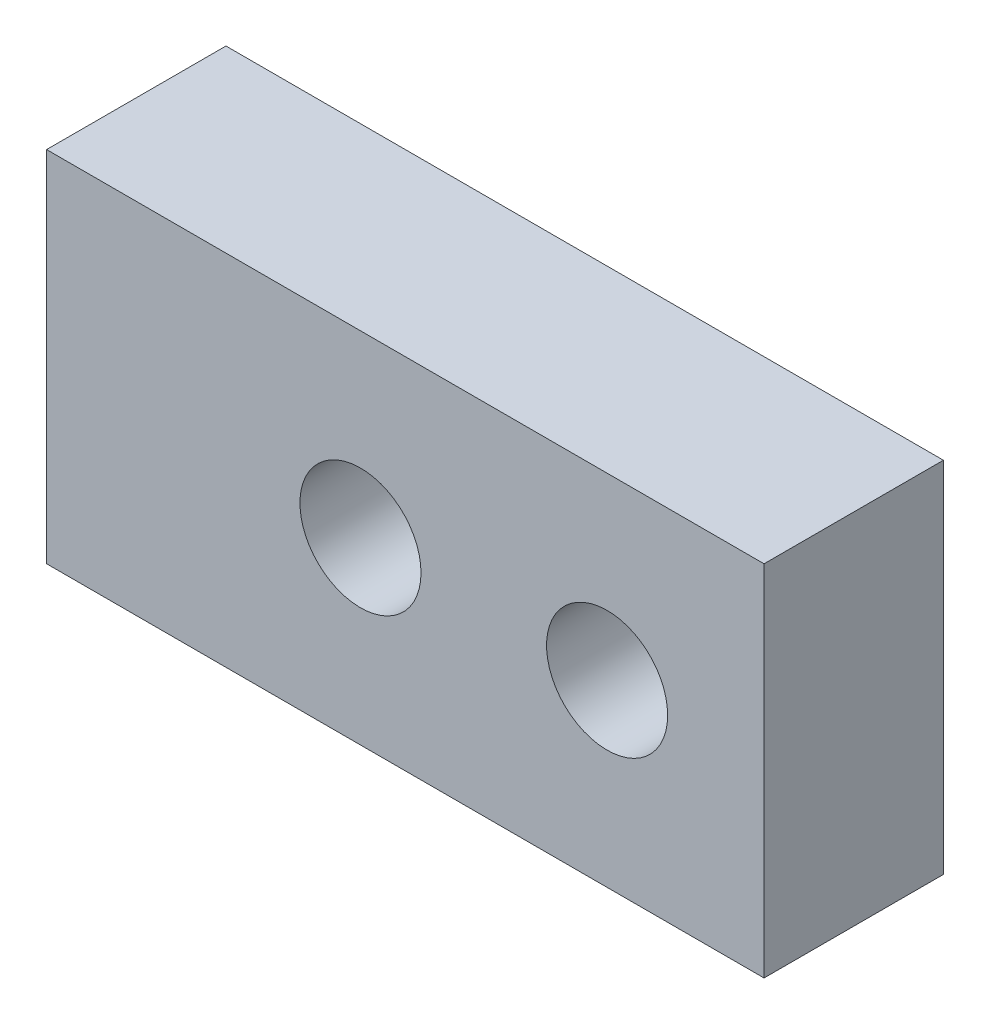
from build123d import *

# Parameters (mm, degrees)
SKETCH1_W           = 16
SKETCH1_H           = 8
SKETCH1_R           = 1.35
BOSS_EXTRUDE1_DEPTH = 4


with BuildPart() as part:
    # Sketch1 → Boss-Extrude1 (new body)
    with BuildSketch(Plane.XY):
        with Locations((8, 4)):
            Rectangle(SKETCH1_W, SKETCH1_H)
        with Locations((12.5, 4)):
            Circle(SKETCH1_R, mode=Mode.SUBTRACT)
        with Locations((7, 4)):
            Circle(SKETCH1_R, mode=Mode.SUBTRACT)
    extrude(amount=BOSS_EXTRUDE1_DEPTH)


solid = part.part
